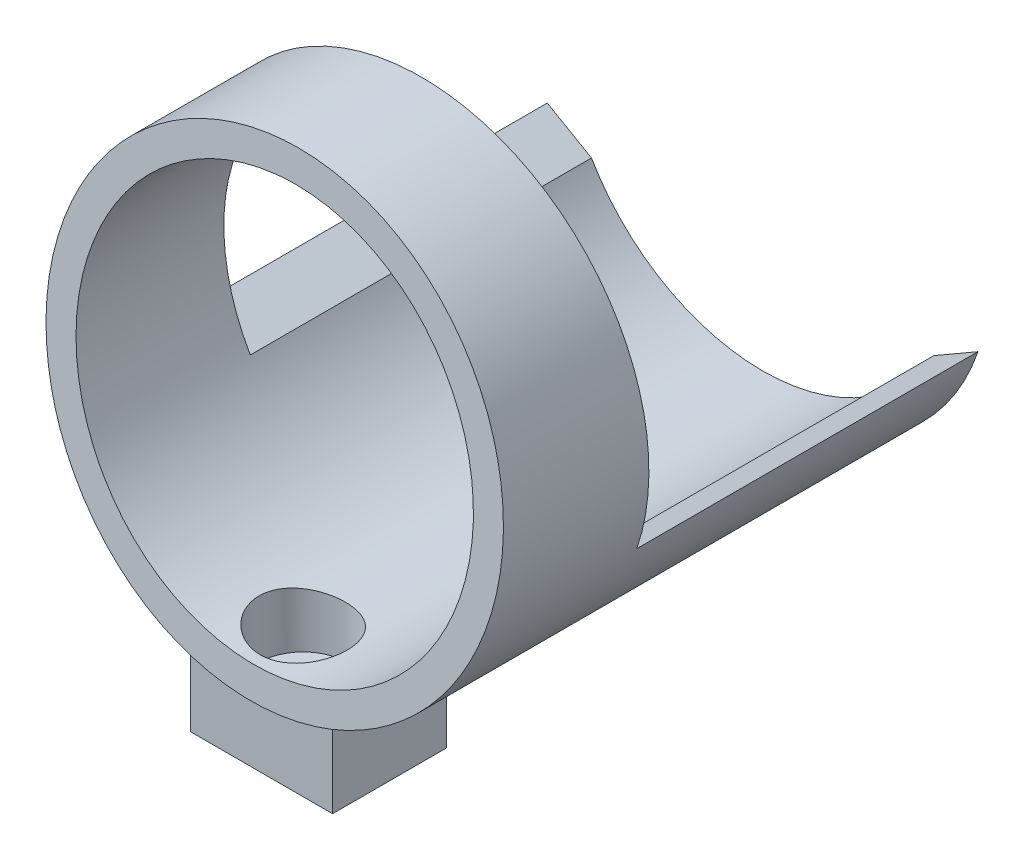
from build123d import *

# Parameters (mm, degrees)
SKETCH1_R                = 16
BOSS_EXTRUDE1_DEPTH      = 36
SKETCH4_R                = 13.9
CUT_EXTRUDE1_DEPTH       = 43.520583251
CUT_EXTRUDE3_DEPTH       = 43.520583251
CUT_EXTRUDE3_DEPTH_BACK  = 43.520583251
BOSS_EXTRUDE2_REACH      = 56.046
BOSS_EXTRUDE2_END_RADIUS = 16
SKETCH8_W                = 10
SKETCH8_H                = 8
SKETCH7_R                = 1.7
CUT_EXTRUDE4_DEPTH       = 25
SKETCH10_R               = 3.1
CUT_EXTRUDE6_DEPTH       = 17.5
CUT_EXTRUDE7_DEPTH       = 24


with BuildPart() as part:
    # Sketch1 → Boss-Extrude1 (new body)
    with BuildSketch(Plane.XY):
        Circle(SKETCH1_R)
    extrude(amount=BOSS_EXTRUDE1_DEPTH)

    # Sketch4 → Cut-Extrude1 (cut, through all)
    with BuildSketch(Plane(origin=(0, 0, 0), x_dir=(-1, 0, 0), z_dir=(0, 0, -1))):
        Circle(SKETCH4_R)
    extrude(amount=-CUT_EXTRUDE1_DEPTH, mode=Mode.SUBTRACT)

    # Sketch6 → Cut-Extrude3 (cut, two sides: drawn at the far end of the back side and taken through both)
    with BuildSketch(Plane(origin=(0, 0, 0), x_dir=(0, 0, -1), z_dir=(1, 0, 0)).offset(-CUT_EXTRUDE3_DEPTH_BACK)):
        Polygon((-36, 16), (-32.636664471, 16), (-36, -16), align=None)
    extrude(amount=CUT_EXTRUDE3_DEPTH + CUT_EXTRUDE3_DEPTH_BACK, mode=Mode.SUBTRACT)

    # Boss-Extrude2: up to this cylinder (the profile starts outside it)
    boss_extrude2_end = Plane(origin=(0, 0, 31), z_dir=(0, 0, -1)) * Cylinder(BOSS_EXTRUDE2_END_RADIUS, 145.092, mode=Mode.PRIVATE)
    # Sketch8 → Boss-Extrude2 (add, up to the surface)
    with BuildSketch(Plane(origin=(0, -21, 0), x_dir=(1, 0, 0), z_dir=(0, 1, 0)), mode=Mode.PRIVATE) as boss_extrude2_sk1:
        with Locations((-0.25, -31)):
            Rectangle(SKETCH8_W, SKETCH8_H)
    boss_extrude2_tool1 = extrude(boss_extrude2_sk1.sketch, amount=BOSS_EXTRUDE2_REACH, mode=Mode.PRIVATE) - boss_extrude2_end
    add(boss_extrude2_tool1.solids().sort_by_distance((-0.25, -21, 31))[0])

    # Sketch7 → Cut-Extrude4 (cut)
    with BuildSketch(Plane(origin=(0, 0, 0), x_dir=(1, 0, 0), z_dir=(0, 1, 0))):
        with Locations(Location((-0.45, -31.867848556, 0), (0, 0, 270))):
            Circle(SKETCH7_R)
    extrude(amount=-CUT_EXTRUDE4_DEPTH, mode=Mode.SUBTRACT)

    # Sketch10 → Cut-Extrude6 (cut)
    with BuildSketch(Plane(origin=(0, 0, 0), x_dir=(1, 0, 0), z_dir=(0, 1, 0))):
        with Locations(Location((-0.45, -31.867848556, 0), (0, 0, 270))):
            Circle(SKETCH10_R)
    extrude(amount=-CUT_EXTRUDE6_DEPTH, mode=Mode.SUBTRACT)

    # Sketch11 → Cut-Extrude7 (cut)
    with BuildSketch(Plane(origin=(0, 0, 0), x_dir=(-1, 0, 0), z_dir=(0, 0, -1))):
        Polygon((-51.788319146, 16), (0, -13.9), (51.788319146, 16), align=None)
    extrude(amount=-CUT_EXTRUDE7_DEPTH, mode=Mode.SUBTRACT)


solid = part.part
